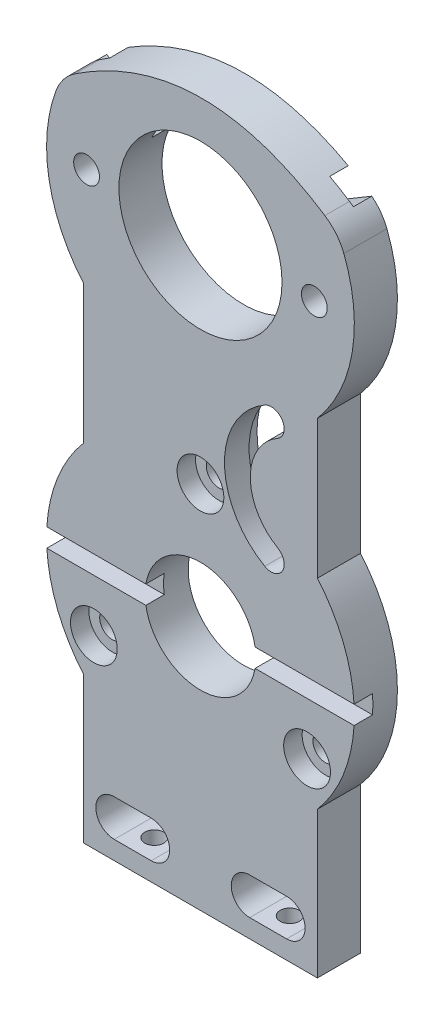
from build123d import *

# Parameters (mm, degrees)
SKETCH_1_R          = 13.25
EXTRUDE_1_DEPTH     = 3.5
SKETCH4_R           = 1.55
CUT_EXTRUDE5_DEPTH  = 5
SKETCH_2_R          = 2.1
CUT_EXTRUDE_1_DEPTH = 10
CUT_EXTRUDE_2_DEPTH = 171.144056611
FILLET_1_R          = 8
CUT_EXTRUDE_3_DEPTH = 3
SKETCH_6_R          = 25
EXTRUDE_2_DEPTH     = 7
SKETCH_7_R          = 9
SKETCH_7_R_2        = 2.05
CUT_EXTRUDE_4_DEPTH = 30
CUT_EXTRUDE_5_DEPTH = 3
SKETCH_11_R         = 3.8
SKETCH_11_R_2       = 2.05
CUT_EXTRUDE_8_DEPTH = 3
CUT_EXTRUDE_6_DEPTH = 10
CUT_EXTRUDE_7_DEPTH = 3


with BuildPart() as part:
    # 草图1 → 凸台-拉伸1 (new, symmetric)
    with BuildSketch(Plane.XY):
        with BuildLine():
            Line((-19, 0), (19, 0))
            Line((19, 0), (19, 78.751923191))
            ThreePointArc((19, 78.751923191), (0, 120), (-19, 78.751923191))
            Line((-19, 78.751923191), (-19, 0))
        make_face()
        with BuildLine():
            ThreePointArc((-8, 9), (-5, 6), (-8, 3))
            Line((-8, 3), (-14, 3))
            ThreePointArc((-14, 3), (-17, 6), (-14, 9))
            Line((-14, 9), (-8, 9))
        make_face(mode=Mode.SUBTRACT)
        with BuildLine():
            ThreePointArc((8, 3), (5, 6), (8, 9))
            Line((8, 9), (14, 9))
            ThreePointArc((14, 9), (17, 6), (14, 3))
            Line((14, 3), (8, 3))
        make_face(mode=Mode.SUBTRACT)
        with Locations((0, 95)):
            Circle(SKETCH_1_R, mode=Mode.SUBTRACT)
    extrude(amount=EXTRUDE_1_DEPTH, both=True)

    # Sketch4 → Cut-Extrude5 (cut)
    with BuildSketch(Plane(origin=(0, 0, 0), x_dir=(-1, 0, 0), z_dir=(0, -1, 0))):
        with Locations(Location((11, 0, 0), (0, 0, 180))):
            Circle(SKETCH4_R)
        with Locations((-11, 0)):
            Circle(SKETCH4_R)
    extrude(amount=-CUT_EXTRUDE5_DEPTH, mode=Mode.SUBTRACT)

    # 草图2 → 切除-拉伸1 (cut)
    with BuildSketch(Plane.XY.offset(3.5)):
        with Locations((-18.5, 95)):
            Circle(SKETCH_2_R)
        with Locations((18.5, 95)):
            Circle(SKETCH_2_R)
    extrude(amount=-CUT_EXTRUDE_1_DEPTH, mode=Mode.SUBTRACT)

    # 草图4 → 切除-拉伸2 (cut, through all)
    with BuildSketch(Plane(origin=(0, 0, -114.5), x_dir=(-1, 0, 0), z_dir=(0, 0, -1))):
        with BuildLine():
            ThreePointArc((22.386292421, 106.128967232), (0.219572962, 119.999035736), (-22.187356595, 106.520469059))
            add(Edge.make_bspline(
                [(-22.187356595, 106.520469059), (0, 122.446847778), (22.386292421, 106.128967232)],
                knots=[0, 0, 0, 1, 1, 1], degree=2))
        make_face()
    extrude(amount=-CUT_EXTRUDE_2_DEPTH, mode=Mode.SUBTRACT)

    # 圆角1
    fillet_1_edges = [part.edges().sort_by_distance(p)[0] for p in [
        (-22.386292421, 106.128967232, 0),
        (22.187356595, 106.520469059, 0),
    ]]
    fillet(fillet_1_edges, radius=FILLET_1_R)

    # 草图5 → 切除-拉伸3 (cut)
    with BuildSketch(Plane.XY.offset(-3.5)):
        Polygon((-22.238605802, 105.815360884), (0, 95), (-0.192853393, 99.54174681), (-22.228779927, 110.258538141), align=None)
        Polygon((-0.192853393, 99.54174681), (0, 95), (21.241716437, 107.661638988), (20.855269273, 112.087989547), align=None)
    extrude(amount=CUT_EXTRUDE_3_DEPTH, mode=Mode.SUBTRACT)

    # 草图6 → 凸台-拉伸2 (add)
    with BuildSketch(Plane.XY.offset(3.5)):
        with Locations((0, 40)):
            Circle(SKETCH_6_R)
    extrude(amount=-EXTRUDE_2_DEPTH)

    # 草图7 → 切除-拉伸4 (cut)
    with BuildSketch(Plane.XY.offset(3.5)):
        with Locations((0, 40)):
            Circle(SKETCH_7_R)
        with Locations((0, 60)):
            Circle(SKETCH_7_R_2)
        with Locations((17.320508076, 30)):
            Circle(SKETCH_7_R_2)
        with Locations((-17.320508076, 30)):
            Circle(SKETCH_7_R_2)
    extrude(amount=-CUT_EXTRUDE_4_DEPTH, mode=Mode.SUBTRACT)

    # 草图8 → 切除-拉伸5 (cut)
    with BuildSketch(Plane(origin=(0, 0, 3.5), x_dir=(-1, 0, 0), z_dir=(0, 0, -1))):
        Polygon((-25, 41.5), (-25, 38.5), (24.954959427, 38.5), (25.455331414, 41.5), align=None)
    extrude(amount=CUT_EXTRUDE_5_DEPTH, mode=Mode.SUBTRACT)

    # 草图11 → 切除-拉伸8 (cut)
    # profile 1 of 3: a face of its own
    with BuildSketch(Plane.XY.offset(3.5)):
        with Locations((0, 60)):
            Circle(SKETCH_11_R)
        with Locations((0, 60)):
            Circle(SKETCH_11_R_2, mode=Mode.SUBTRACT)
    # profile 2 of 3: a face of its own
    with BuildSketch(Plane.XY.offset(3.5)):
        with Locations((-17.320508076, 30)):
            Circle(SKETCH_11_R)
        with Locations((-17.320508076, 30)):
            Circle(SKETCH_11_R_2, mode=Mode.SUBTRACT)
    # profile 3 of 3: a face of its own
    with BuildSketch(Plane.XY.offset(3.5)):
        with Locations((17.320508076, 30)):
            Circle(SKETCH_11_R)
        with Locations((17.320508076, 30)):
            Circle(SKETCH_11_R_2, mode=Mode.SUBTRACT)
    extrude(amount=-CUT_EXTRUDE_8_DEPTH, mode=Mode.SUBTRACT)

    # 草图9 → 切除-拉伸6 (cut)
    with BuildSketch(Plane(origin=(0, 0, -3.5), x_dir=(-1, 0, 0), z_dir=(0, 0, -1))):
        with BuildLine():
            ThreePointArc((-10.45, 53.65506721), (-3.9, 65), (-10.45, 76.34493279))
            ThreePointArc((-10.45, 76.34493279), (-13.318653348, 75.576279442), (-12.55, 72.707626094))
            ThreePointArc((-12.55, 72.707626094), (-8.1, 65), (-12.55, 57.292373906))
            ThreePointArc((-12.55, 57.292373906), (-13.318653348, 54.423720558), (-10.45, 53.65506721))
        make_face()
    extrude(amount=-CUT_EXTRUDE_6_DEPTH, mode=Mode.SUBTRACT)

    # 草图10 → 切除-拉伸7 (cut)
    with BuildSketch(Plane(origin=(0, 0, -3.5), x_dir=(-1, 0, 0), z_dir=(0, 0, -1))):
        with BuildLine():
            ThreePointArc((-9.595, 52.17416377), (-2.19, 65), (-9.595, 77.82583623))
            ThreePointArc((-9.595, 77.82583623), (-14.799556788, 76.431279442), (-13.405, 71.226722653))
            ThreePointArc((-13.405, 71.226722653), (-9.81, 65), (-13.405, 58.773277347))
            ThreePointArc((-13.405, 58.773277347), (-14.799556788, 53.568720558), (-9.595, 52.17416377))
        make_face()
        with BuildLine():
            ThreePointArc((-12.55, 57.292373906), (-13.318653348, 54.423720558), (-10.45, 53.65506721))
            ThreePointArc((-10.45, 53.65506721), (-3.9, 65), (-10.45, 76.34493279))
            ThreePointArc((-10.45, 76.34493279), (-13.318653348, 75.576279442), (-12.55, 72.707626094))
            ThreePointArc((-12.55, 72.707626094), (-8.1, 65), (-12.55, 57.292373906))
        make_face(mode=Mode.SUBTRACT)
    extrude(amount=-CUT_EXTRUDE_7_DEPTH, mode=Mode.SUBTRACT)


solid = part.part
